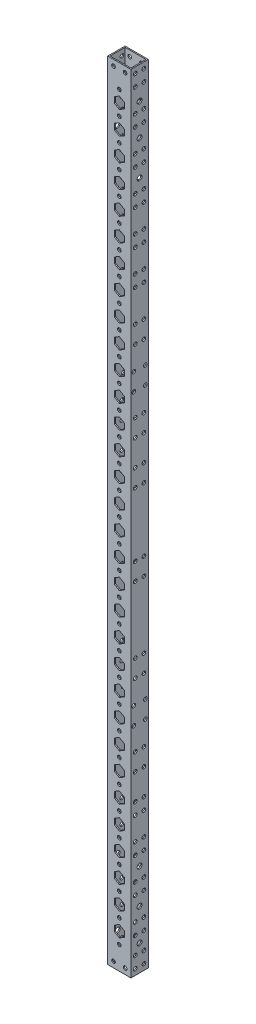
from build123d import *

# Parameters (mm, degrees)
SKETCH_1_W          = 20
SKETCH_1_H          = 15
SKETCH_1_W_2        = 18
SKETCH_1_H_2        = 13
EXTRUDE_1_DEPTH     = 680
SKETCH_2_R          = 1.575
CUT_EXTRUDE_1_DEPTH = 681.238928613
SKETCH_3_R          = 1.575
SKETCH_3_R_2        = 1.6
SKETCH_3_R_3        = 2.1
CUT_EXTRUDE_2_DEPTH = 681.335395228


with BuildPart() as part:
    # 草图1 → 拉伸-薄壁1 (new body)
    with BuildSketch(Plane(origin=(0, 0, 0), x_dir=(1, 0, 0), z_dir=(0, 1, 0))):
        Rectangle(SKETCH_1_W, SKETCH_1_H)
        Rectangle(SKETCH_1_W_2, SKETCH_1_H_2, mode=Mode.SUBTRACT)
    extrude(amount=EXTRUDE_1_DEPTH)

    # 草图2 → 切除-拉伸1 (cut, through all)
    with BuildSketch(Plane(origin=(0, 0, -7.5), x_dir=(-1, 0, 0), z_dir=(0, 0, -1))):
        with Locations((-5, 675)):
            Circle(SKETCH_2_R)
        with Locations((5, 675)):
            Circle(SKETCH_2_R)
        with Locations((5, 5)):
            Circle(SKETCH_2_R)
        with Locations((-5, 5)):
            Circle(SKETCH_2_R)
        with Locations((0, 660)):
            Circle(SKETCH_2_R)
        with Locations((0, 640)):
            Circle(SKETCH_2_R)
        with Locations((0, 620)):
            Circle(SKETCH_2_R)
        with Locations((0, 600)):
            Circle(SKETCH_2_R)
        with Locations((0, 580)):
            Circle(SKETCH_2_R)
        with Locations((0, 560)):
            Circle(SKETCH_2_R)
        with Locations((0, 540)):
            Circle(SKETCH_2_R)
        with Locations((0, 520)):
            Circle(SKETCH_2_R)
        with Locations((0, 500)):
            Circle(SKETCH_2_R)
        with Locations((0, 480)):
            Circle(SKETCH_2_R)
        with Locations((0, 460)):
            Circle(SKETCH_2_R)
        with Locations((0, 440)):
            Circle(SKETCH_2_R)
        with Locations((0, 420)):
            Circle(SKETCH_2_R)
        with Locations((0, 400)):
            Circle(SKETCH_2_R)
        with Locations((0, 380)):
            Circle(SKETCH_2_R)
        with Locations((0, 360)):
            Circle(SKETCH_2_R)
        with Locations((0, 340)):
            Circle(SKETCH_2_R)
        with Locations((0, 320)):
            Circle(SKETCH_2_R)
        with Locations((0, 300)):
            Circle(SKETCH_2_R)
        with Locations((0, 280)):
            Circle(SKETCH_2_R)
        with Locations((0, 260)):
            Circle(SKETCH_2_R)
        with Locations((0, 240)):
            Circle(SKETCH_2_R)
        with Locations((0, 220)):
            Circle(SKETCH_2_R)
        with Locations((0, 200)):
            Circle(SKETCH_2_R)
        with Locations((0, 180)):
            Circle(SKETCH_2_R)
        with Locations((0, 160)):
            Circle(SKETCH_2_R)
        with Locations((0, 140)):
            Circle(SKETCH_2_R)
        with Locations((0, 120)):
            Circle(SKETCH_2_R)
        with Locations((0, 100)):
            Circle(SKETCH_2_R)
        with Locations((0, 80)):
            Circle(SKETCH_2_R)
        with Locations((0, 60)):
            Circle(SKETCH_2_R)
        with Locations((0, 40)):
            Circle(SKETCH_2_R)
        with Locations((0, 20)):
            Circle(SKETCH_2_R)
        Polygon((-4.330127019, 32.500847386), (-4.330127019, 27.500847386), (0, 25.000847386), (4.330127019, 27.500847386), (4.330127019, 32.500847386), (0, 35.000847386), align=None)
        Polygon((0, 55.000847386), (-4.330127019, 52.500847386), (-4.330127019, 47.500847386), (0, 45.000847386), (4.330127019, 47.500847386), (4.330127019, 52.500847386), align=None)
        Polygon((0, 75.000847386), (-4.330127019, 72.500847386), (-4.330127019, 67.500847386), (0, 65.000847386), (4.330127019, 67.500847386), (4.330127019, 72.500847386), align=None)
        Polygon((0, 95.000847386), (-4.330127019, 92.500847386), (-4.330127019, 87.500847386), (0, 85.000847386), (4.330127019, 87.500847386), (4.330127019, 92.500847386), align=None)
        Polygon((0, 115.000847386), (-4.330127019, 112.500847386), (-4.330127019, 107.500847386), (0, 105.000847386), (4.330127019, 107.500847386), (4.330127019, 112.500847386), align=None)
        Polygon((0, 135.000847386), (-4.330127019, 132.500847386), (-4.330127019, 127.500847386), (0, 125.000847386), (4.330127019, 127.500847386), (4.330127019, 132.500847386), align=None)
        Polygon((0, 155.000847386), (-4.330127019, 152.500847386), (-4.330127019, 147.500847386), (0, 145.000847386), (4.330127019, 147.500847386), (4.330127019, 152.500847386), align=None)
        Polygon((0, 175.000847386), (-4.330127019, 172.500847386), (-4.330127019, 167.500847386), (0, 165.000847386), (4.330127019, 167.500847386), (4.330127019, 172.500847386), align=None)
        Polygon((0, 195.000847386), (-4.330127019, 192.500847386), (-4.330127019, 187.500847386), (0, 185.000847386), (4.330127019, 187.500847386), (4.330127019, 192.500847386), align=None)
        Polygon((0, 215.000847386), (-4.330127019, 212.500847386), (-4.330127019, 207.500847386), (0, 205.000847386), (4.330127019, 207.500847386), (4.330127019, 212.500847386), align=None)
        Polygon((0, 235.000847386), (-4.330127019, 232.500847386), (-4.330127019, 227.500847386), (0, 225.000847386), (4.330127019, 227.500847386), (4.330127019, 232.500847386), align=None)
        Polygon((0, 255.000847386), (-4.330127019, 252.500847386), (-4.330127019, 247.500847386), (0, 245.000847386), (4.330127019, 247.500847386), (4.330127019, 252.500847386), align=None)
        Polygon((0, 275.000847386), (-4.330127019, 272.500847386), (-4.330127019, 267.500847386), (0, 265.000847386), (4.330127019, 267.500847386), (4.330127019, 272.500847386), align=None)
        Polygon((0, 295.000847386), (-4.330127019, 292.500847386), (-4.330127019, 287.500847386), (0, 285.000847386), (4.330127019, 287.500847386), (4.330127019, 292.500847386), align=None)
        Polygon((0, 315.000847386), (-4.330127019, 312.500847386), (-4.330127019, 307.500847386), (0, 305.000847386), (4.330127019, 307.500847386), (4.330127019, 312.500847386), align=None)
        Polygon((0, 335.000847386), (-4.330127019, 332.500847386), (-4.330127019, 327.500847386), (0, 325.000847386), (4.330127019, 327.500847386), (4.330127019, 332.500847386), align=None)
        Polygon((0, 355.000847386), (-4.330127019, 352.500847386), (-4.330127019, 347.500847386), (0, 345.000847386), (4.330127019, 347.500847386), (4.330127019, 352.500847386), align=None)
        Polygon((0, 375.000847386), (-4.330127019, 372.500847386), (-4.330127019, 367.500847386), (0, 365.000847386), (4.330127019, 367.500847386), (4.330127019, 372.500847386), align=None)
        Polygon((0, 395.000847386), (-4.330127019, 392.500847386), (-4.330127019, 387.500847386), (0, 385.000847386), (4.330127019, 387.500847386), (4.330127019, 392.500847386), align=None)
        Polygon((0, 415.000847386), (-4.330127019, 412.500847386), (-4.330127019, 407.500847386), (0, 405.000847386), (4.330127019, 407.500847386), (4.330127019, 412.500847386), align=None)
        Polygon((0, 435.000847386), (-4.330127019, 432.500847386), (-4.330127019, 427.500847386), (0, 425.000847386), (4.330127019, 427.500847386), (4.330127019, 432.500847386), align=None)
        Polygon((0, 455.000847386), (-4.330127019, 452.500847386), (-4.330127019, 447.500847386), (0, 445.000847386), (4.330127019, 447.500847386), (4.330127019, 452.500847386), align=None)
        Polygon((0, 475.000847386), (-4.330127019, 472.500847386), (-4.330127019, 467.500847386), (0, 465.000847386), (4.330127019, 467.500847386), (4.330127019, 472.500847386), align=None)
        Polygon((0, 495.000847386), (-4.330127019, 492.500847386), (-4.330127019, 487.500847386), (0, 485.000847386), (4.330127019, 487.500847386), (4.330127019, 492.500847386), align=None)
        Polygon((0, 515.000847386), (-4.330127019, 512.500847386), (-4.330127019, 507.500847386), (0, 505.000847386), (4.330127019, 507.500847386), (4.330127019, 512.500847386), align=None)
        Polygon((0, 535.000847386), (-4.330127019, 532.500847386), (-4.330127019, 527.500847386), (0, 525.000847386), (4.330127019, 527.500847386), (4.330127019, 532.500847386), align=None)
        Polygon((0, 555.000847386), (-4.330127019, 552.500847386), (-4.330127019, 547.500847386), (0, 545.000847386), (4.330127019, 547.500847386), (4.330127019, 552.500847386), align=None)
        Polygon((0, 575.000847386), (-4.330127019, 572.500847386), (-4.330127019, 567.500847386), (0, 565.000847386), (4.330127019, 567.500847386), (4.330127019, 572.500847386), align=None)
        Polygon((0, 595.000847386), (-4.330127019, 592.500847386), (-4.330127019, 587.500847386), (0, 585.000847386), (4.330127019, 587.500847386), (4.330127019, 592.500847386), align=None)
        Polygon((0, 615.000847386), (-4.330127019, 612.500847386), (-4.330127019, 607.500847386), (0, 605.000847386), (4.330127019, 607.500847386), (4.330127019, 612.500847386), align=None)
        Polygon((0, 635.000847386), (-4.330127019, 632.500847386), (-4.330127019, 627.500847386), (0, 625.000847386), (4.330127019, 627.500847386), (4.330127019, 632.500847386), align=None)
        Polygon((0, 655.000847386), (-4.330127019, 652.500847386), (-4.330127019, 647.500847386), (0, 645.000847386), (4.330127019, 647.500847386), (4.330127019, 652.500847386), align=None)
    extrude(amount=-CUT_EXTRUDE_1_DEPTH, mode=Mode.SUBTRACT)

    # 草图3 → 切除-拉伸2 (cut, through all)
    with BuildSketch(Plane.ZY.offset(10)):
        with Locations((-5, 452.5)):
            Circle(SKETCH_3_R)
        with Locations(Location((5, 452.5, 0), (0, 0, 0.03082645))):
            Circle(SKETCH_3_R)
        with Locations((5, 437.5)):
            Circle(SKETCH_3_R)
        with Locations(Location((-5, 437.5, 0), (0, 0, 180))):
            Circle(SKETCH_3_R)
        with Locations((-5, 202.5)):
            Circle(SKETCH_3_R)
        with Locations(Location((5, 202.5, 0), (0, 0, 180))):
            Circle(SKETCH_3_R)
        with Locations((5, 187.5)):
            Circle(SKETCH_3_R)
        with Locations(Location((-5, 187.5, 0), (0, 0, 162.247209838))):
            Circle(SKETCH_3_R)
        with Locations((-3.75, 487.5)):
            Circle(SKETCH_3_R)
        with Locations(Location((-3.75, 472.5, 0), (0, 0, 180))):
            Circle(SKETCH_3_R)
        with Locations((3.75, 472.5)):
            Circle(SKETCH_3_R)
        with Locations(Location((3.75, 487.5, 0), (0, 0, 180))):
            Circle(SKETCH_3_R)
        with Locations(Location((3.75, 417.5, 0), (0, 0, 180))):
            Circle(SKETCH_3_R)
        with Locations((-3.75, 417.5)):
            Circle(SKETCH_3_R)
        with Locations((3.75, 402.5)):
            Circle(SKETCH_3_R)
        with Locations(Location((-3.75, 402.5, 0), (0, 0, 180))):
            Circle(SKETCH_3_R)
        with Locations((-3.75, 167.5)):
            Circle(SKETCH_3_R)
        with Locations(Location((3.75, 167.5, 0), (0, 0, 180))):
            Circle(SKETCH_3_R)
        with Locations((3.75, 152.5)):
            Circle(SKETCH_3_R)
        with Locations(Location((-3.75, 152.5, 0), (0, 0, 180))):
            Circle(SKETCH_3_R)
        with Locations((-3.75, 237.5)):
            Circle(SKETCH_3_R)
        with Locations(Location((3.75, 237.5, 0), (0, 0, 180))):
            Circle(SKETCH_3_R)
        with Locations((3.75, 222.5)):
            Circle(SKETCH_3_R)
        with Locations(Location((-3.75, 222.5, 0), (0, 0, 180))):
            Circle(SKETCH_3_R)
        with Locations((3.75, 5)):
            Circle(SKETCH_3_R_2)
        with Locations(Location((-3.75, 5, 0), (0, 0, 180))):
            Circle(SKETCH_3_R_2)
        with Locations(Location((3.75, 15, 0), (0, 0, 180))):
            Circle(SKETCH_3_R_2)
        with Locations((-3.75, 15)):
            Circle(SKETCH_3_R_2)
        with Locations((3.75, 365)):
            Circle(SKETCH_3_R_2)
        with Locations(Location((-3.75, 365, 0), (0, 0, 180))):
            Circle(SKETCH_3_R_2)
        with Locations((-3.75, 380)):
            Circle(SKETCH_3_R_2)
        with Locations(Location((3.75, 380, 0), (0, 0, 180))):
            Circle(SKETCH_3_R_2)
        with Locations((3.75, 295)):
            Circle(SKETCH_3_R_2)
        with Locations(Location((-3.75, 295, 0), (0, 0, 180))):
            Circle(SKETCH_3_R_2)
        with Locations((-3.75, 310)):
            Circle(SKETCH_3_R_2)
        with Locations(Location((3.75, 310, 0), (0, 0, 180))):
            Circle(SKETCH_3_R_2)
        with Locations((-3.75, 675)):
            Circle(SKETCH_3_R_2)
        with Locations(Location((3.75, 675, 0), (0, 0, 180))):
            Circle(SKETCH_3_R_2)
        with Locations((3.75, 665)):
            Circle(SKETCH_3_R_2)
        with Locations(Location((-3.75, 665, 0), (0, 0, 180))):
            Circle(SKETCH_3_R_2)
        with Locations((-3.75, 645)):
            Circle(SKETCH_3_R_2)
        with Locations(Location((3.75, 645, 0), (0, 0, 180))):
            Circle(SKETCH_3_R_2)
        with Locations(Location((-3.75, 635, 0), (0, 0, 180))):
            Circle(SKETCH_3_R_2)
        with Locations((3.75, 635)):
            Circle(SKETCH_3_R_2)
        with Locations((-3.75, 615)):
            Circle(SKETCH_3_R_2)
        with Locations(Location((3.75, 615, 0), (0, 0, 180))):
            Circle(SKETCH_3_R_2)
        with Locations(Location((-3.75, 605, 0), (0, 0, 180))):
            Circle(SKETCH_3_R_2)
        with Locations((3.75, 605)):
            Circle(SKETCH_3_R_2)
        with Locations((-3.75, 585)):
            Circle(SKETCH_3_R_2)
        with Locations(Location((3.75, 585, 0), (0, 0, 180))):
            Circle(SKETCH_3_R_2)
        with Locations(Location((-3.75, 575, 0), (0, 0, 180))):
            Circle(SKETCH_3_R_2)
        with Locations((3.75, 575)):
            Circle(SKETCH_3_R_2)
        with Locations((-3.75, 555)):
            Circle(SKETCH_3_R_2)
        with Locations(Location((3.75, 555, 0), (0, 0, 180))):
            Circle(SKETCH_3_R_2)
        with Locations(Location((-3.75, 545, 0), (0, 0, 180))):
            Circle(SKETCH_3_R_2)
        with Locations((3.75, 545)):
            Circle(SKETCH_3_R_2)
        with Locations((-3.75, 525)):
            Circle(SKETCH_3_R_2)
        with Locations(Location((3.75, 525, 0), (0, 0, 180))):
            Circle(SKETCH_3_R_2)
        with Locations(Location((-3.75, 515, 0), (0, 0, 180))):
            Circle(SKETCH_3_R_2)
        with Locations((3.75, 515)):
            Circle(SKETCH_3_R_2)
        with Locations(Location((3.75, 130, 0), (0, 0, 180))):
            Circle(SKETCH_3_R_2)
        with Locations((-3.75, 130)):
            Circle(SKETCH_3_R_2)
        with Locations((3.75, 120)):
            Circle(SKETCH_3_R_2)
        with Locations(Location((-3.75, 120, 0), (0, 0, 180))):
            Circle(SKETCH_3_R_2)
        with Locations(Location((3.75, 100, 0), (0, 0, 180))):
            Circle(SKETCH_3_R_2)
        with Locations((-3.75, 100)):
            Circle(SKETCH_3_R_2)
        with Locations((3.75, 90)):
            Circle(SKETCH_3_R_2)
        with Locations(Location((-3.75, 90, 0), (0, 0, 180))):
            Circle(SKETCH_3_R_2)
        with Locations(Location((3.75, 70, 0), (0, 0, 180))):
            Circle(SKETCH_3_R_2)
        with Locations((-3.75, 70)):
            Circle(SKETCH_3_R_2)
        with Locations((3.75, 60)):
            Circle(SKETCH_3_R_2)
        with Locations(Location((-3.75, 60, 0), (0, 0, 180))):
            Circle(SKETCH_3_R_2)
        with Locations(Location((3.75, 40, 0), (0, 0, 180))):
            Circle(SKETCH_3_R_2)
        with Locations((-3.75, 40)):
            Circle(SKETCH_3_R_2)
        with Locations((3.75, 30)):
            Circle(SKETCH_3_R_2)
        with Locations(Location((-3.75, 30, 0), (0, 0, 180))):
            Circle(SKETCH_3_R_2)
        with Locations((0, 22.5)):
            Circle(SKETCH_3_R_3)
        with Locations((0, 50)):
            Circle(SKETCH_3_R_3)
        with Locations(Location((0, 652.5, 0), (0, 0, 180))):
            Circle(SKETCH_3_R_3)
        with Locations(Location((0, 625, 0), (0, 0, 180))):
            Circle(SKETCH_3_R_3)
        with Locations((0, 80)):
            Circle(SKETCH_3_R_3)
        with Locations(Location((0, 595, 0), (0, 0, 180))):
            Circle(SKETCH_3_R_3)
    extrude(amount=-CUT_EXTRUDE_2_DEPTH, mode=Mode.SUBTRACT)


solid = part.part
